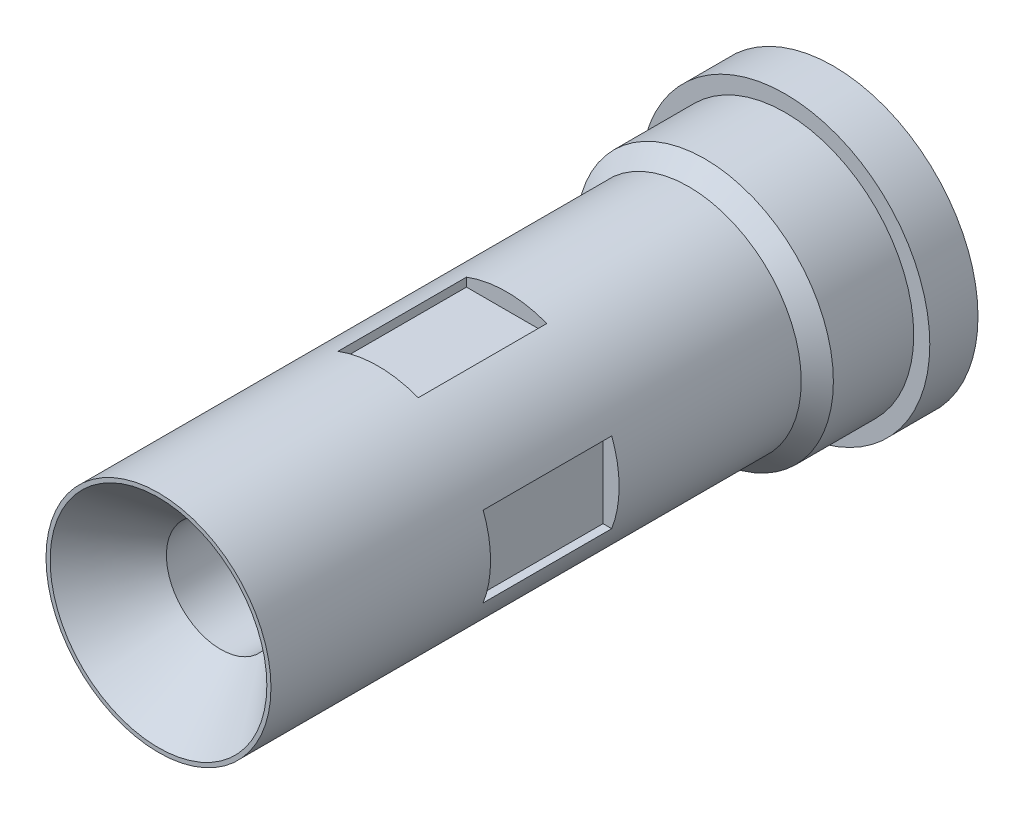
from build123d import *

# Parameters (mm, degrees)
SKETCH1_R                                           = 9
BOSS_EXTRUDE1_DEPTH                                 = 4
SKETCH2_R                                           = 7
BOSS_EXTRUDE2_DEPTH                                 = 39
CSK_FOR_1_4_FLAT_HEAD_SOCKET_CAP_SCREW1_D           = 6.7564
CSK_FOR_1_4_FLAT_HEAD_SOCKET_CAP_SCREW1_CSINK_D     = 13.4874
CSK_FOR_1_4_FLAT_HEAD_SOCKET_CAP_SCREW1_CSINK_ANGLE = 82
SKETCH6_R                                           = 16
CUT_EXTRUDE1_DEPTH                                  = 1
SKETCH7_R                                           = 4
CUT_EXTRUDE2_DEPTH                                  = 3
SKETCH9_W                                           = 8
SKETCH9_H                                           = 5
CUT_EXTRUDE3_DEPTH                                  = 3
CIRPATTERN1_COUNT                                   = 4
SKETCH10_R                                          = 8
BOSS_EXTRUDE3_DEPTH                                 = 5
SKETCH11_R                                          = 7
CUT_EXTRUDE4_START                                  = -9
SKETCH12_R                                          = 3.3782
CUT_EXTRUDE4_DEPTH                                  = 9


with BuildPart() as part:
    # Sketch1 → Boss-Extrude1 (new body)
    with BuildSketch(Plane.XY):
        Circle(SKETCH1_R)
    extrude(amount=BOSS_EXTRUDE1_DEPTH)

    # Sketch2 → Boss-Extrude2 (add)
    with BuildSketch(Plane.XY.offset(4)):
        Circle(SKETCH2_R)
    extrude(amount=BOSS_EXTRUDE2_DEPTH)

    # CSK for 1/4 Flat Head Socket Cap Screw1 (through all)
    with Locations(Plane.XY.offset(43)):
        with Locations((0, 0)):
            CounterSinkHole(CSK_FOR_1_4_FLAT_HEAD_SOCKET_CAP_SCREW1_D / 2, CSK_FOR_1_4_FLAT_HEAD_SOCKET_CAP_SCREW1_CSINK_D / 2, counter_sink_angle=CSK_FOR_1_4_FLAT_HEAD_SOCKET_CAP_SCREW1_CSINK_ANGLE)

    # Sketch6 → Cut-Extrude1 (cut)
    with BuildSketch(Plane(origin=(0, 0, 0), x_dir=(-1, 0, 0), z_dir=(0, 0, -1))):
        Circle(SKETCH6_R)
    extrude(amount=-CUT_EXTRUDE1_DEPTH, mode=Mode.SUBTRACT)

    # Sketch7 → Cut-Extrude2 (cut)
    with BuildSketch(Plane(origin=(0, 0, 1), x_dir=(-1, 0, 0), z_dir=(0, 0, -1))):
        Circle(SKETCH7_R)
    extrude(amount=-CUT_EXTRUDE2_DEPTH, mode=Mode.SUBTRACT)

    # Sketch9 → Cut-Extrude3 (cut)
    with BuildSketch(Plane(origin=(6, 0, 0), x_dir=(0, 0, -1), z_dir=(1, 0, 0))):
        with Locations((-25.333705971, 0)):
            Rectangle(SKETCH9_W, SKETCH9_H)
    cut_extrude3 = extrude(amount=CUT_EXTRUDE3_DEPTH, mode=Mode.SUBTRACT)

    # CirPattern1: Cut-Extrude3 ×4 about axis
    cirpattern1_axis = Axis((0, 0, 0), (0, 0, 1))
    for i in range(1, CIRPATTERN1_COUNT):
        add(cut_extrude3.rotate(cirpattern1_axis, i * 360 / CIRPATTERN1_COUNT), mode=Mode.SUBTRACT)

    # Sketch10 → Boss-Extrude3 (add)
    with BuildSketch(Plane.XY.offset(4)):
        Circle(SKETCH10_R)
    extrude(amount=BOSS_EXTRUDE3_DEPTH)

    # Sketch11 → section 1 of loft4
    with BuildSketch(Plane.XY.offset(10), mode=Mode.PRIVATE) as loft4_s1:
        Circle(SKETCH11_R)
    # loft up to a face of the part (loft4)
    loft([Face(Wire([part.edges().sort_by_distance((-5.476376847, 5.831749019, 9))[0]])), loft4_s1.sketch])

    # Sketch12 → Cut-Extrude4 (cut)
    with BuildSketch(Plane.XY.offset(10).offset(CUT_EXTRUDE4_START)):
        Circle(SKETCH12_R)
    extrude(amount=CUT_EXTRUDE4_DEPTH, mode=Mode.SUBTRACT)


solid = part.part
